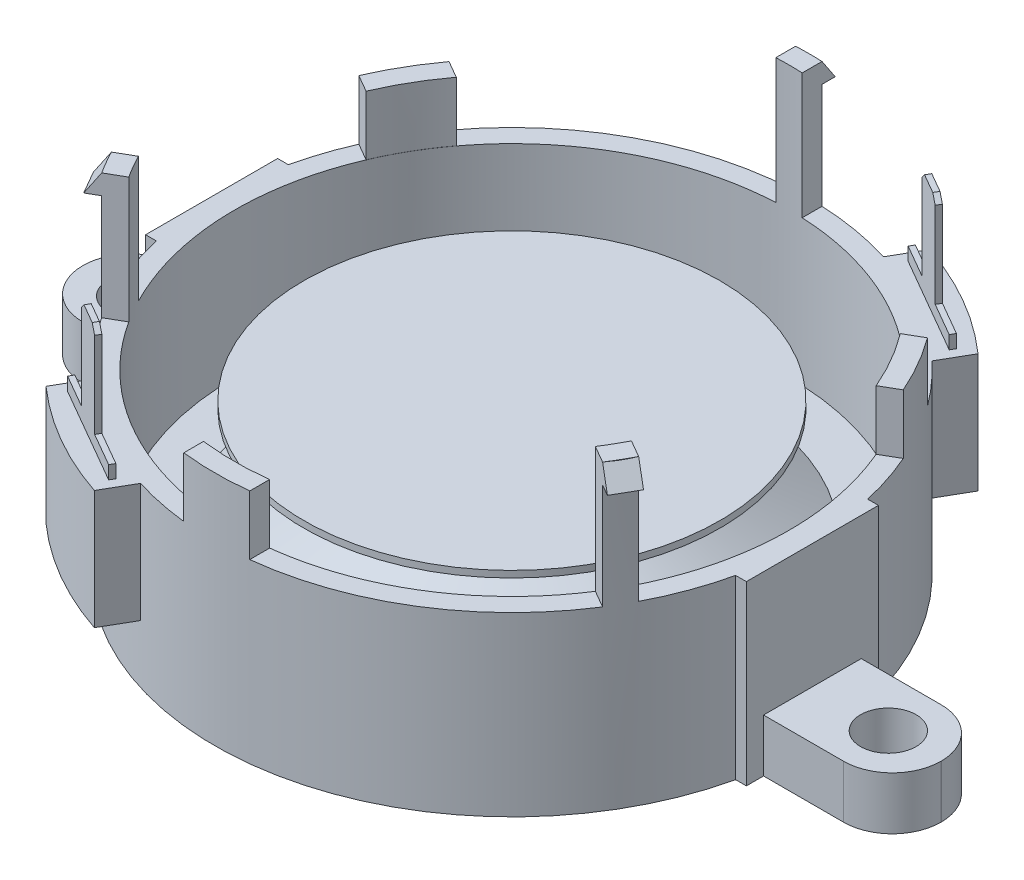
from build123d import *
from build123d.topology import SkipClean

# Parameters (mm, degrees)
SKETCH_1_R               = 22.5
EXTRUDE_1_DEPTH          = 13.4
SKETCH_2_R               = 2.1
EXTRUDE_2_DEPTH          = 4
FILLET_1_R               = 3.69
EXTRUDE_3_DEPTH          = 9.5
EXTRUDE_5_DEPTH          = 2
EXTRUDE_4_DEPTH          = 4.5
CUT_EXTRUDE_START        = -11
SKETCH_5_R               = 21.001588026
CUT_EXTRUDE_1_DEPTH      = 11
SKETCH_6_R               = 8
CUT_EXTRUDE_2_DEPTH      = 3
PATTERN_CIRCULAR_1_COUNT = 3
EXTRUDE_START            = -9
EXTRUDE_6_DEPTH          = 9
EXTRUDE_7_DEPTH          = 1
EXTRUDE_8_DEPTH          = 7
CHAMFER_1_SIZE           = 0.5
SKETCH_13_R              = 9.5
CUT_EXTRUDE_4_DEPTH      = 2
EXTRUDE_10_DEPTH         = 13.4


with BuildPart() as part:
    # Эскиз1 → Бобышка-Вытянуть1 (new body)
    with BuildSketch(Plane(origin=(0, 0, 0), x_dir=(1, 0, 0), z_dir=(0, 1, 0))):
        with Locations(Location((0, 0, 0), (0, 0, 270))):
            Circle(SKETCH_1_R)
    extrude(amount=EXTRUDE_1_DEPTH)

    # Эскиз2 → Бобышка-Вытянуть2 (add)
    # profile 1 of 2: a face of its own
    with BuildSketch(Plane.XZ):
        with BuildLine():
            Line((22.193692798, 3.7), (32.5, 3.7))
            Line((32.5, 3.7), (32.5, -3.7))
            Line((32.5, -3.7), (22.193692798, -3.7))
            ThreePointArc((22.193692798, -3.7), (22.5, 0), (22.193692798, 3.7))
        make_face()
        with Locations(Location((28.5, 0, 0), (0, 0, 270))):
            Circle(SKETCH_2_R, mode=Mode.SUBTRACT)
    # profile 2 of 2: a face of its own
    with BuildSketch(Plane.XZ):
        with BuildLine():
            Line((-22.193692798, -3.7), (-32.5, -3.7))
            Line((-32.5, -3.7), (-32.5, 3.7))
            Line((-32.5, 3.7), (-22.193692798, 3.7))
            ThreePointArc((-22.193692798, 3.7), (-22.5, 0), (-22.193692798, -3.7))
        make_face()
        with Locations(Location((-28.5, 0, 0), (0, 0, 90))):
            Circle(SKETCH_2_R, mode=Mode.SUBTRACT)
    extrude(amount=-EXTRUDE_2_DEPTH)

    # Скругление1
    fillet_1_edges = [part.edges().sort_by_distance(p)[0] for p in [
        (-32.5, 2, -3.7),
        (-32.5, 2, 3.7),
        (32.5, 2, 3.7),
        (32.5, 2, -3.7),
    ]]
    fillet(fillet_1_edges, radius=FILLET_1_R)

    # Эскиз3 → Бобышка-Вытянуть3 (add)
    with BuildSketch(Plane(origin=(0, 13.4, 0), x_dir=(1, 0, 0), z_dir=(0, 1, 0))):
        with BuildLine():
            Line((-1, 22.477766793), (-1, 20.977766793))
            ThreePointArc((-1, 20.977766793), (0, 21.001588026), (1, 20.977766793))
            Line((1, 20.977766793), (1, 22.477766793))
            ThreePointArc((1, 22.477766793), (0, 22.5), (-1, 22.477766793))
        make_face()
        with BuildLine():
            Line((19.966317063, -10.372857993), (18.667278957, -9.622857993))
            ThreePointArc((18.667278957, -9.622857993), (18.18790875, -10.500794013), (17.667278957, -11.3549088))
            Line((17.667278957, -11.3549088), (18.966317063, -12.1049088))
            ThreePointArc((18.966317063, -12.1049088), (19.485571585, -11.25), (19.966317063, -10.372857993))
        make_face()
        with BuildLine():
            Line((-18.966317063, -12.1049088), (-17.667278957, -11.3549088))
            ThreePointArc((-17.667278957, -11.3549088), (-18.18790875, -10.500794013), (-18.667278957, -9.622857993))
            Line((-18.667278957, -9.622857993), (-19.966317063, -10.372857993))
            ThreePointArc((-19.966317063, -10.372857993), (-19.485571585, -11.25), (-18.966317063, -12.1049088))
        make_face()
    extrude(amount=EXTRUDE_3_DEPTH)

    # Эскиз7 → Бобышка-Вытянуть5 (add)
    with BuildSketch(Plane.ZY.offset(1)):
        Polygon((-22.477766793, 22.9), (-23.477766793, 21.4), (-22.477766793, 21.4), align=None)
    extrude_5 = extrude(amount=-EXTRUDE_5_DEPTH)

    # Эскиз4 → Бобышка-Вытянуть4 (add)
    with BuildSketch(Plane(origin=(0, 13.4, 0), x_dir=(1, 0, 0), z_dir=(0, 1, 0))):
        with BuildLine():
            Line((-2.5, -20.860679775), (-2.5, -22.360679775))
            ThreePointArc((-2.5, -22.360679775), (0, -22.5), (2.5, -22.360679775))
            Line((2.5, -22.360679775), (2.5, -20.860679775))
            ThreePointArc((2.5, -20.860679775), (0, -21.009949088), (-2.5, -20.860679775))
        make_face()
        with BuildLine():
            Line((-16.815878625, 12.595403397), (-18.114916731, 13.345403397))
            ThreePointArc((-18.114916731, 13.345403397), (-19.485571585, 11.25), (-20.614916731, 9.015276378))
            Line((-20.614916731, 9.015276378), (-19.315878625, 8.265276378))
            ThreePointArc((-19.315878625, 8.265276378), (-18.195149642, 10.504974544), (-16.815878625, 12.595403397))
        make_face()
        with BuildLine():
            Line((19.315878625, 8.265276378), (20.614916731, 9.015276378))
            ThreePointArc((20.614916731, 9.015276378), (19.485571585, 11.25), (18.114916731, 13.345403397))
            Line((18.114916731, 13.345403397), (16.815878625, 12.595403397))
            ThreePointArc((16.815878625, 12.595403397), (18.195149642, 10.504974544), (19.315878625, 8.265276378))
        make_face()
    extrude(amount=EXTRUDE_4_DEPTH)

    # Эскиз5 → Вырез-Вытянуть1 (cut)
    with SkipClean():  # the faces are left unmerged after this step: merging them gives an invalid solid
        with BuildSketch(Plane(origin=(0, 13.4, 0), x_dir=(1, 0, 0), z_dir=(0, 1, 0)).offset(CUT_EXTRUDE_START)):
            with Locations(Location((0, 0, 0), (0, 0, 87.270803902))):
                Circle(SKETCH_5_R)
        extrude(amount=CUT_EXTRUDE_1_DEPTH, mode=Mode.SUBTRACT)

    # Эскиз6 → Вырез-Вытянуть2 (cut)
    with SkipClean():  # the faces are left unmerged after this step: merging them gives an invalid solid
        with BuildSketch(Plane(origin=(0, 0, 0), x_dir=(-1, 0, 0), z_dir=(0, -1, 0))):
            with Locations(Location((0, 0, 0), (0, 0, 90))):
                Circle(SKETCH_6_R)
        extrude(amount=-CUT_EXTRUDE_2_DEPTH, mode=Mode.SUBTRACT)

    # Круговой массив1: Бобышка-Вытянуть5 ×3 about axis
    with SkipClean():  # the faces are left unmerged after this step: merging them gives an invalid solid
        pattern_circular_1_axis = Axis((0, 0, 0), (0, 1, 0))
        for i in range(1, PATTERN_CIRCULAR_1_COUNT):
            add(extrude_5.rotate(pattern_circular_1_axis, i * 360 / PATTERN_CIRCULAR_1_COUNT))

    # Эскиз8 → Бобышка-Вытянуть6 (add)
    with SkipClean():  # the faces are left unmerged after this step: merging them gives an invalid solid
        with BuildSketch(Plane(origin=(0, 13.4, 0), x_dir=(1, 0, 0), z_dir=(0, 1, 0)).offset(EXTRUDE_START)):
            with BuildLine():
                Line((7.917321695, 23.713203436), (6.638578465, 21.498355192))
                ThreePointArc((6.638578465, 21.498355192), (11.25, 19.485571585), (15.298832503, 16.498355192))
                Line((15.298832503, 16.498355192), (16.577575733, 18.713203436))
                ThreePointArc((16.577575733, 18.713203436), (12.5, 21.650635095), (7.917321695, 23.713203436))
            make_face()
            with BuildLine():
                Line((-7.917321695, -23.713203436), (-6.638578465, -21.498355192))
                ThreePointArc((-6.638578465, -21.498355192), (-11.25, -19.485571585), (-15.298832503, -16.498355192))
                Line((-15.298832503, -16.498355192), (-16.577575733, -18.713203436))
                ThreePointArc((-16.577575733, -18.713203436), (-12.5, -21.650635095), (-7.917321695, -23.713203436))
            make_face()
        extrude(amount=EXTRUDE_6_DEPTH)

    # Эскиз9 → Бобышка-Вытянуть7 (add)
    with SkipClean():  # the faces are left unmerged after this step: merging them gives an invalid solid
        with BuildSketch(Plane(origin=(0, 13.4, 0), x_dir=(1, 0, 0), z_dir=(0, 1, 0))):
            Polygon((8.069392034, 22.476596989), (7.869392034, 22.130186827), (15.230607966, 17.880186827), (15.430607966, 18.226596989), align=None)
            Polygon((-8.069392034, -22.476596989), (-15.430607966, -18.226596989), (-15.230607966, -17.880186827), (-7.869392034, -22.130186827), align=None)
        extrude(amount=EXTRUDE_7_DEPTH)

    # Эскиз10 → Бобышка-Вытянуть8 (add)
    with SkipClean():  # the faces are left unmerged after this step: merging them gives an invalid solid
        with BuildSketch(Plane(origin=(0, 14.4, 0), x_dir=(1, 0, 0), z_dir=(0, 1, 0))):
            Polygon((10.580865705, 21.026596989), (10.380865705, 20.680186827), (12.719134295, 19.330186827), (12.919134295, 19.676596989), align=None)
            Polygon((-10.580865705, -21.026596989), (-12.919134295, -19.676596989), (-12.719134295, -19.330186827), (-10.380865705, -20.680186827), align=None)
        extrude(amount=EXTRUDE_8_DEPTH)

    # Фаска1
    chamfer_1_edges = [part.edges().sort_by_distance(p)[0] for p in [
        (10.480865705, 21.4, -20.853391908),
        (12.819134295, 21.4, -19.503391908),
        (-10.480865705, 21.4, 20.853391908),
        (-12.819134295, 21.4, 19.503391908),
    ]]
    chamfer(chamfer_1_edges, length=CHAMFER_1_SIZE)

    # Эскиз11 → Повернуть1 (revolve)
    with SkipClean():  # the faces are left unmerged after this step: merging them gives an invalid solid
        with BuildSketch(Plane(origin=(0, 0, 0), x_dir=(0, 0, -1), z_dir=(1, 0, 0))):
            Polygon((20.5, 2.4), (17.5, 2.4), (4.99, 9.622651868), (4.99, 10.9), (15.74, 10.9), (15.74, 11.4), (-0.01, 11.4), (-0.01, 10.9), (4.49, 10.9), (4.49, 9.333976733), (17.366025404, 1.9), (20.5, 1.9), align=None)
        revolve(axis=Axis((0, 0, 0.01), (0, 1, 0)))

    # Эскиз13 → Вырез-Вытянуть4 (cut)
    with SkipClean():  # the faces are left unmerged after this step: merging them gives an invalid solid
        with BuildSketch(Plane.XZ):
            with Locations(Location((0, 0, 0), (0, 0, 270))):
                Circle(SKETCH_13_R)
        extrude(amount=-CUT_EXTRUDE_4_DEPTH, mode=Mode.SUBTRACT)

    # Эскиз15 → Бобышка-Вытянуть10 (add)
    with SkipClean():  # the faces are left unmerged after this step: merging them gives an invalid solid
        with BuildSketch(Plane.XZ):
            with BuildLine():
                Line((-21.937410968, 5), (-22.75, 5))
                Line((-22.75, 5), (-22.75, -5))
                Line((-22.75, -5), (-21.937410968, -5))
                ThreePointArc((-21.937410968, -5), (-22.5, 0), (-21.937410968, 5))
            make_face()
            with BuildLine():
                Line((22.75, 5), (22.75, -5))
                Line((22.75, -5), (21.937410968, -5))
                ThreePointArc((21.937410968, -5), (22.5, 0), (21.937410968, 5))
                Line((21.937410968, 5), (22.75, 5))
            make_face()
        extrude(amount=-EXTRUDE_10_DEPTH)


solid = part.part
